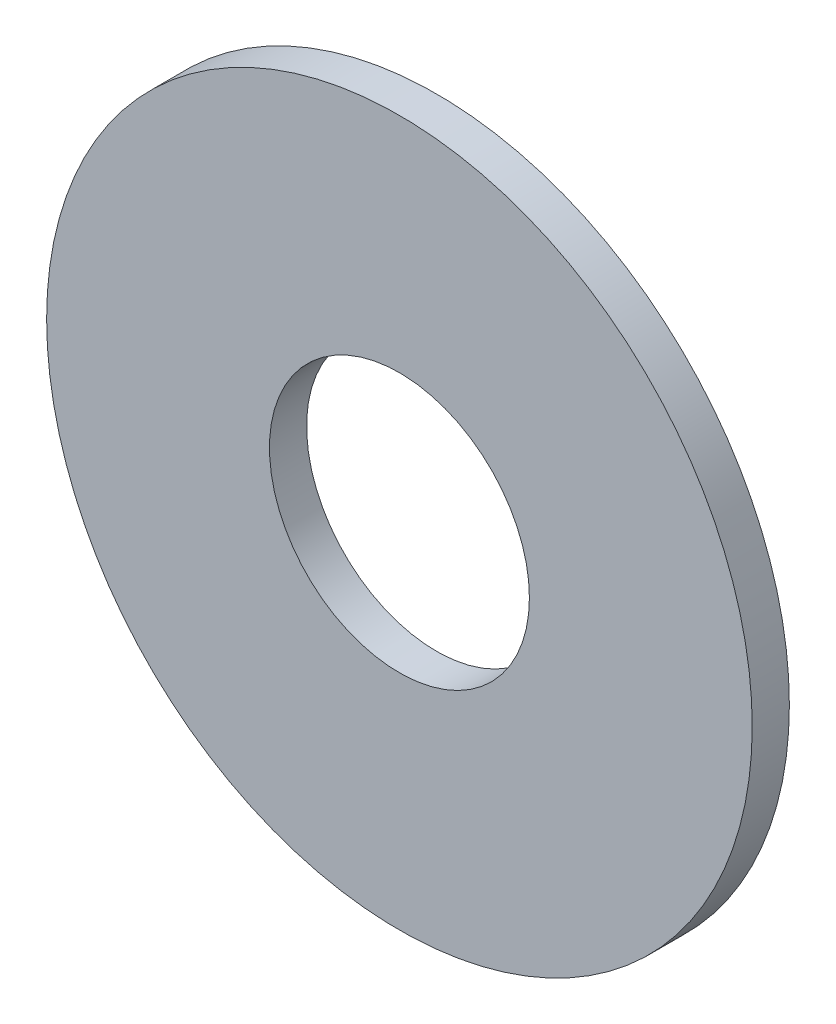
from build123d import *

# Parameters (mm, degrees)
SKETCH1_R           = 4.75
SKETCH1_R_2         = 1.75
BOSS_EXTRUDE1_DEPTH = 0.5


with BuildPart() as part:
    # Sketch1 → Boss-Extrude1 (new body)
    with BuildSketch(Plane.XY):
        Circle(SKETCH1_R)
        Circle(SKETCH1_R_2, mode=Mode.SUBTRACT)
    extrude(amount=BOSS_EXTRUDE1_DEPTH)


solid = part.part
